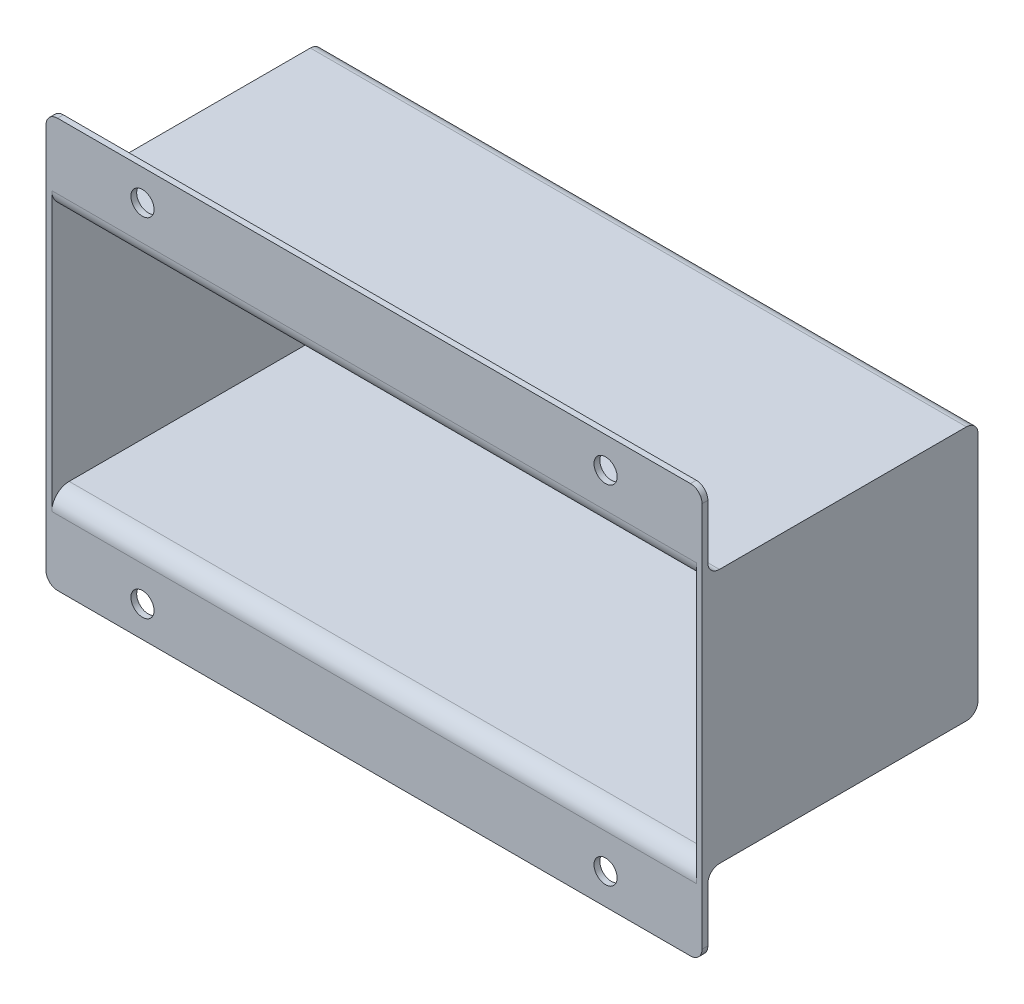
from build123d import *

# Parameters (mm, degrees)
SKETCH_1_W               = 170
SKETCH_1_H               = 66
EXTRUDE_1_DEPTH          = 70
SKETCH_2_W               = 170
SKETCH_2_H               = 106
EXTRUDE_2_DEPTH          = 5
FILLET_1_R               = 3
SHELL_1_T                = -1.5
CUT_EXTRUDE_1_DEPTH      = 204.502456988
CUT_EXTRUDE_1_DEPTH_BACK = 5
SKETCH_3_W               = 3.5
SKETCH_3_H               = 106
SKETCH_4_R               = 11
CUT_EXTRUDE_2_DEPTH      = 5
SKETCH_5_R               = 3
CUT_EXTRUDE_3_DEPTH      = 5
FILLET_2_R               = 3


with BuildPart() as part:
    # 草图1 → 凸台-拉伸1 (new body)
    with BuildSketch(Plane.XY):
        with Locations((85, 33)):
            Rectangle(SKETCH_1_W, SKETCH_1_H)
    extrude(amount=EXTRUDE_1_DEPTH)

    # 草图2 → 凸台-拉伸2 (add)
    with BuildSketch(Plane.XY.offset(70)):
        with Locations((85, 33)):
            Rectangle(SKETCH_2_W, SKETCH_2_H)
    extrude(amount=EXTRUDE_2_DEPTH)

    # 圆角1
    fillet_1_edges = [part.edges().sort_by_distance(p)[0] for p in [
        (85, 0, 70),
        (85, 0, 0),
        (85, 66, 0),
        (85, 66, 70),
    ]]
    fillet(fillet_1_edges, radius=FILLET_1_R)

    # 抽壳1
    shell_1_openings = [part.faces().sort_by_distance(p)[0] for p in [
        (85, -20, 72.5),
        (85, 86, 72.5),
        (85, 33, 75),
    ]]
    offset(amount=SHELL_1_T, openings=shell_1_openings, kind=Kind.INTERSECTION)

    # 草图3 → 切除-拉伸1 (cut, two sides: drawn at the far end of the back side and taken through both)
    with BuildSketch(Plane.ZY.offset(-168.5).offset(-CUT_EXTRUDE_1_DEPTH_BACK)):
        with Locations((73.25, 33)):
            Rectangle(SKETCH_3_W, SKETCH_3_H)
    extrude(amount=CUT_EXTRUDE_1_DEPTH + CUT_EXTRUDE_1_DEPTH_BACK, mode=Mode.SUBTRACT)

    # 草图4 → 切除-拉伸2 (cut)
    with BuildSketch(Plane(origin=(0, 0, 0), x_dir=(-1, 0, 0), z_dir=(0, 0, -1))):
        with Locations((-135, 33)):
            Circle(SKETCH_4_R)
        with Locations((-85, 33)):
            Circle(SKETCH_4_R)
        with Locations((-35, 33)):
            Circle(SKETCH_4_R)
    extrude(amount=-CUT_EXTRUDE_2_DEPTH, mode=Mode.SUBTRACT)

    # 草图5 → 切除-拉伸3 (cut)
    with BuildSketch(Plane.XY.offset(71.5)):
        with Locations((145, -12)):
            Circle(SKETCH_5_R)
        with Locations((25, -12)):
            Circle(SKETCH_5_R)
        with Locations((25, 78)):
            Circle(SKETCH_5_R)
        with Locations((145, 78)):
            Circle(SKETCH_5_R)
    extrude(amount=-CUT_EXTRUDE_3_DEPTH, mode=Mode.SUBTRACT)

    # 圆角2
    fillet_2_edges = [part.edges().sort_by_distance(p)[0] for p in [
        (170, 86, 70.75),
        (0, 86, 70.75),
        (0, -20, 70.75),
        (170, -20, 70.75),
    ]]
    fillet(fillet_2_edges, radius=FILLET_2_R)


solid = part.part
